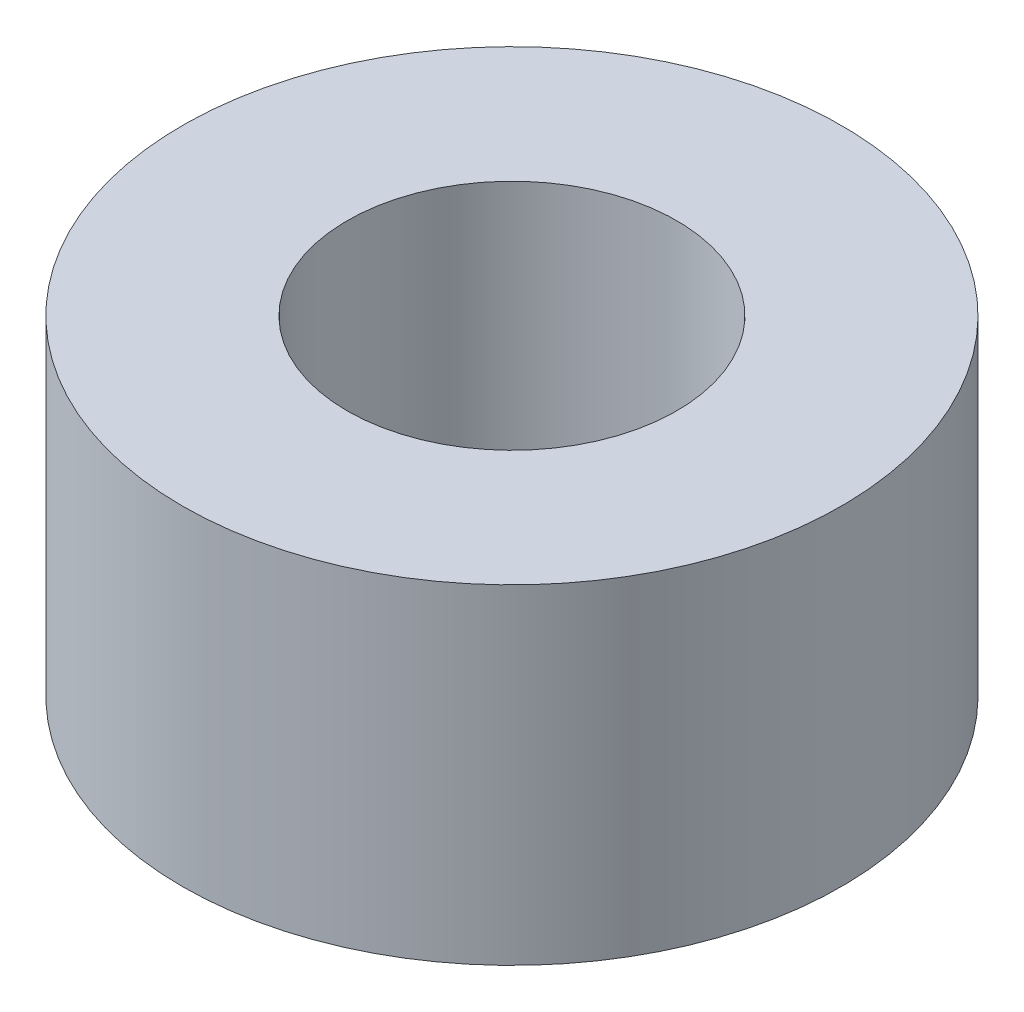
from build123d import *

# Parameters (mm, degrees)
ESBO_O1_R                = 3
ESBO_O1_R_2              = 1.5
RESSALTO_EXTRUS_O1_DEPTH = 3


with BuildPart() as part:
    # Esboço1 → Ressalto-extrusão1 (new body)
    with BuildSketch(Plane(origin=(0, 0, 0), x_dir=(1, 0, 0), z_dir=(0, 1, 0))):
        with Locations(Location((0, 0, 0), (0, 0, 270))):
            Circle(ESBO_O1_R)
        with Locations(Location((0, 0, 0), (0, 0, 270))):
            Circle(ESBO_O1_R_2, mode=Mode.SUBTRACT)
    extrude(amount=RESSALTO_EXTRUS_O1_DEPTH)


solid = part.part
